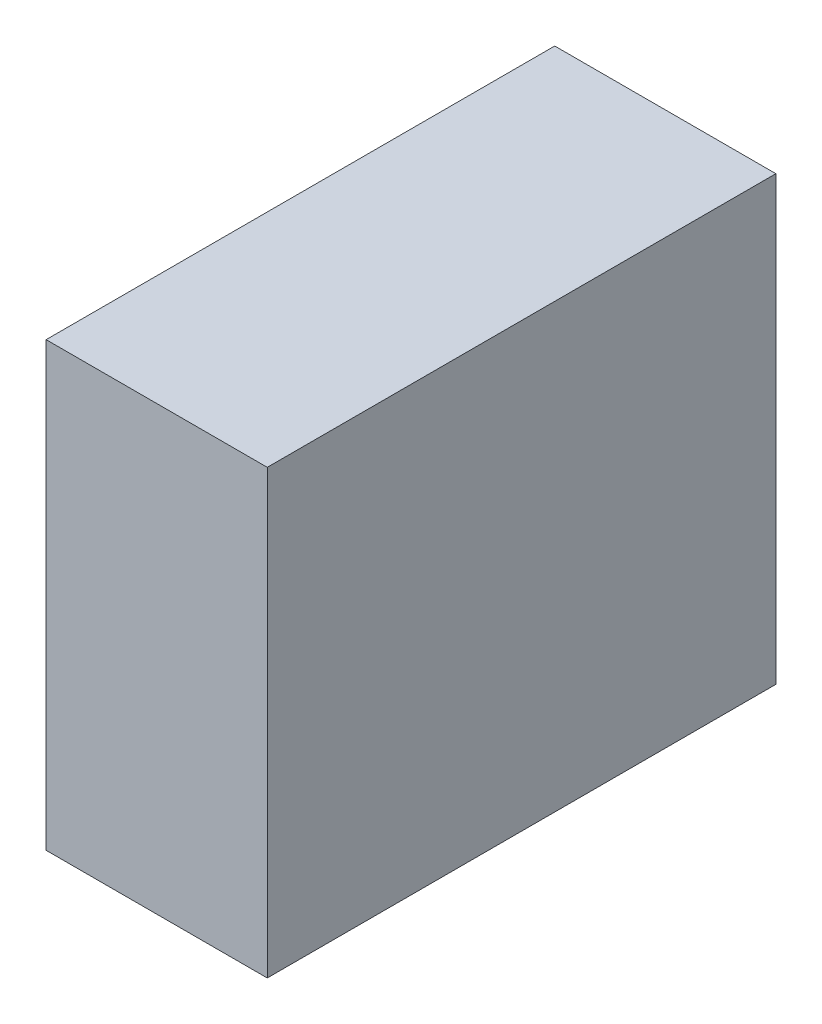
from build123d import *

# Parameters (mm, degrees)
SKETCH1_W           = 23
SKETCH1_H           = 20
BOSS_EXTRUDE1_DEPTH = 10


with BuildPart() as part:
    # Sketch1 → Boss-Extrude1 (new body)
    with BuildSketch(Plane(origin=(0, 0, 0), x_dir=(0, 0, -1), z_dir=(1, 0, 0))):
        with Locations((11.5, 10)):
            Rectangle(SKETCH1_W, SKETCH1_H)
    extrude(amount=-BOSS_EXTRUDE1_DEPTH)


solid = part.part
